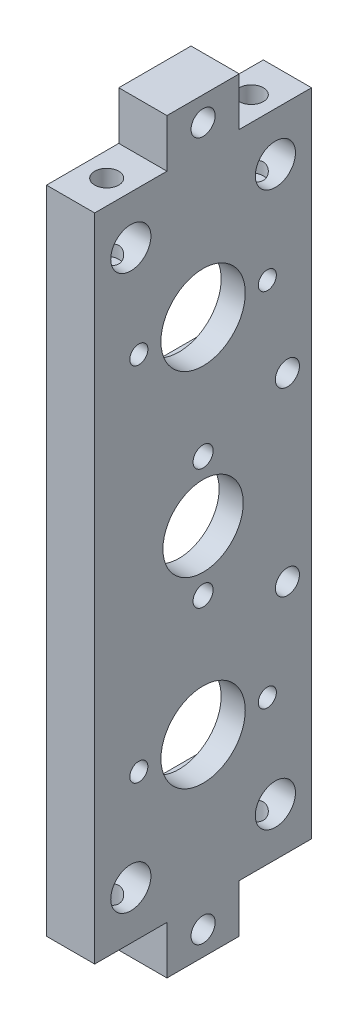
from build123d import *

# Parameters (mm, degrees)
SKETCH2_W           = 54
SKETCH2_H           = 162
SKETCH2_R           = 10
SKETCH2_R_2         = 10.5
BOSS_EXTRUDE1_DEPTH = 12
SKETCH3_W           = 18
SKETCH3_H           = 12
BOSS_EXTRUDE2_DEPTH = 12
CUT_EXTRUDE1_REACH  = 99.581
SKETCH4_R           = 2.25
LPATTERN1_COUNT     = 2
LPATTERN1_PITCH     = 90
CUT_EXTRUDE2_DEPTH  = 6
CUT_EXTRUDE3_REACH  = 99.581
SKETCH6_R           = 5
SKETCH8_R           = 5
CUT_EXTRUDE4_DEPTH  = 6
CUT_EXTRUDE5_REACH  = 99.026
SKETCH9_R           = 3
SKETCH10_R          = 3
CUT_EXTRUDE6_DEPTH  = 19
CUT_EXTRUDE7_REACH  = 99.581
SKETCH11_R          = 3
CUT_EXTRUDE8_DEPTH  = 6
CUT_EXTRUDE9_REACH  = 99.581
SKETCH13_R          = 2.5
CUT_EXTRUDE10_DEPTH = 6


with BuildPart() as part:
    # Sketch2 → Boss-Extrude1 (new body)
    with BuildSketch(Plane(origin=(0, 0, 0), x_dir=(0, 0, -1), z_dir=(1, 0, 0))):
        Rectangle(SKETCH2_W, SKETCH2_H)
        Circle(SKETCH2_R, mode=Mode.SUBTRACT)
        with Locations((0, 45)):
            Circle(SKETCH2_R_2, mode=Mode.SUBTRACT)
        with Locations((0, -45)):
            Circle(SKETCH2_R_2, mode=Mode.SUBTRACT)
    extrude(amount=BOSS_EXTRUDE1_DEPTH)

    # Sketch3 → Boss-Extrude2 (add)
    with BuildSketch(Plane(origin=(12, 0, 0), x_dir=(0, 0, -1), z_dir=(1, 0, 0))):
        with Locations((0, -87)):
            Rectangle(SKETCH3_W, SKETCH3_H)
    boss_extrude2 = extrude(amount=-BOSS_EXTRUDE2_DEPTH)

    # Mirror1: Boss-Extrude2 across plane
    add(boss_extrude2.mirror(Plane.ZX))

    # Sketch4 → Cut-Extrude1 (cut, up to next)
    with BuildSketch(Plane(origin=(12, 0, 0), x_dir=(0, 0, -1), z_dir=(1, 0, 0)), mode=Mode.PRIVATE) as cut_extrude1_sk1:
        with Locations((-16, -45)):
            Circle(SKETCH4_R)
    cut_extrude1_tool1 = extrude(cut_extrude1_sk1.sketch, amount=-CUT_EXTRUDE1_REACH, mode=Mode.PRIVATE) & part.part
    # Sketch4 → Cut-Extrude1 (cut, up to next)
    with BuildSketch(Plane(origin=(12, 0, 0), x_dir=(0, 0, -1), z_dir=(1, 0, 0)), mode=Mode.PRIVATE) as cut_extrude1_sk2:
        with Locations((16, -45)):
            Circle(SKETCH4_R)
    cut_extrude1_tool2 = extrude(cut_extrude1_sk2.sketch, amount=-CUT_EXTRUDE1_REACH, mode=Mode.PRIVATE) & part.part
    cut_extrude1_1 = cut_extrude1_tool1.solids().sort_by_distance((12, -45, 16))[0]
    add(cut_extrude1_1, mode=Mode.SUBTRACT)
    cut_extrude1_2 = cut_extrude1_tool2.solids().sort_by_distance((12, -45, -16))[0]
    add(cut_extrude1_2, mode=Mode.SUBTRACT)
    cut_extrude1 = cut_extrude1_1 + cut_extrude1_2  # Cut-Extrude1 as one shape, for the pattern or mirror that repeats it

    # LPattern1: Cut-Extrude1 ×2
    with Locations(*[(0, i * LPATTERN1_PITCH, 0) for i in range(1, LPATTERN1_COUNT)]):
        add(cut_extrude1, mode=Mode.SUBTRACT)

    # Sketch5 → Cut-Extrude2 (cut)
    with BuildSketch(Plane.ZY):
        with BuildLine():
            Line((16.992645468, 29.5), (-16.992645468, 29.5))
            ThreePointArc((-16.992645468, 29.5), (-23, 45), (-16.992645468, 60.5))
            Line((-16.992645468, 60.5), (16.992645468, 60.5))
            ThreePointArc((16.992645468, 60.5), (23, 45), (16.992645468, 29.5))
        make_face()
        with BuildLine():
            Line((16.992645468, -60.5), (-16.992645468, -60.5))
            ThreePointArc((-16.992645468, -60.5), (-23, -45), (-16.992645468, -29.5))
            Line((-16.992645468, -29.5), (16.992645468, -29.5))
            ThreePointArc((16.992645468, -29.5), (23, -45), (16.992645468, -60.5))
        make_face()
    extrude(amount=-CUT_EXTRUDE2_DEPTH, mode=Mode.SUBTRACT)

    # Sketch6 → Cut-Extrude3 (cut, up to next)
    with BuildSketch(Plane.ZY, mode=Mode.PRIVATE) as cut_extrude3_sk1:
        with Locations((-18, -69)):
            Circle(SKETCH6_R)
    cut_extrude3_tool1 = extrude(cut_extrude3_sk1.sketch, amount=-CUT_EXTRUDE3_REACH, mode=Mode.PRIVATE) & part.part
    # Sketch6 → Cut-Extrude3 (cut, up to next)
    with BuildSketch(Plane.ZY, mode=Mode.PRIVATE) as cut_extrude3_sk2:
        with Locations((18, -69)):
            Circle(SKETCH6_R)
    cut_extrude3_tool2 = extrude(cut_extrude3_sk2.sketch, amount=-CUT_EXTRUDE3_REACH, mode=Mode.PRIVATE) & part.part
    cut_extrude3_1 = cut_extrude3_tool1.solids().sort_by_distance((0, -69, -18))[0]
    add(cut_extrude3_1, mode=Mode.SUBTRACT)
    cut_extrude3_2 = cut_extrude3_tool2.solids().sort_by_distance((0, -69, 18))[0]
    add(cut_extrude3_2, mode=Mode.SUBTRACT)
    cut_extrude3 = cut_extrude3_1 + cut_extrude3_2  # Cut-Extrude3 as one shape, for the pattern or mirror that repeats it

    # Sketch8 → Cut-Extrude4 (cut)
    with BuildSketch(Plane.ZY):
        with Locations((0, -87)):
            Circle(SKETCH8_R)
    cut_extrude4 = extrude(amount=-CUT_EXTRUDE4_DEPTH, mode=Mode.SUBTRACT)

    # Sketch9 → Cut-Extrude5 (cut, up to next)
    with BuildSketch(Plane.ZY.offset(-6), mode=Mode.PRIVATE) as cut_extrude5_sk1:
        with Locations((0, -87)):
            Circle(SKETCH9_R)
    cut_extrude5_tool1 = extrude(cut_extrude5_sk1.sketch, amount=-CUT_EXTRUDE5_REACH, mode=Mode.PRIVATE) & part.part
    cut_extrude5 = cut_extrude5_tool1.solids().sort_by_distance((6, -87, 0))[0]
    add(cut_extrude5, mode=Mode.SUBTRACT)

    # Sketch10 → Cut-Extrude6 (cut)
    with BuildSketch(Plane.XZ.offset(81)):
        with Locations((6, -18)):
            Circle(SKETCH10_R)
        with Locations((6, 18)):
            Circle(SKETCH10_R)
    cut_extrude6 = extrude(amount=-CUT_EXTRUDE6_DEPTH, mode=Mode.SUBTRACT)

    # Sketch11 → Cut-Extrude7 (cut, up to next)
    with BuildSketch(Plane.ZY, mode=Mode.PRIVATE) as cut_extrude7_sk1:
        with Locations((-21, -22.5)):
            Circle(SKETCH11_R)
    cut_extrude7_tool1 = extrude(cut_extrude7_sk1.sketch, amount=-CUT_EXTRUDE7_REACH, mode=Mode.PRIVATE) & part.part
    cut_extrude7 = cut_extrude7_tool1.solids().sort_by_distance((0, -22.5, -21))[0]
    add(cut_extrude7, mode=Mode.SUBTRACT)

    # Sketch12 → Cut-Extrude8 (cut)
    with BuildSketch(Plane.ZY):
        with BuildLine():
            Line((-21, -27.5), (-27, -27.5))
            Line((-27, -27.5), (-27, -17.5))
            Line((-27, -17.5), (-21, -17.5))
            ThreePointArc((-21, -17.5), (-16, -22.5), (-21, -27.5))
        make_face()
    cut_extrude8 = extrude(amount=-CUT_EXTRUDE8_DEPTH, mode=Mode.SUBTRACT)

    # Mirror2: Cut-Extrude3, Cut-Extrude4, Cut-Extrude5, Cut-Extrude6, Cut-Extrude7, Cut-Extrude8 across plane
    add(cut_extrude3.mirror(Plane.ZX), mode=Mode.SUBTRACT)
    add(cut_extrude4.mirror(Plane.ZX), mode=Mode.SUBTRACT)
    add(cut_extrude5.mirror(Plane.ZX), mode=Mode.SUBTRACT)
    add(cut_extrude6.mirror(Plane.ZX), mode=Mode.SUBTRACT)
    add(cut_extrude7.mirror(Plane.ZX), mode=Mode.SUBTRACT)
    add(cut_extrude8.mirror(Plane.ZX), mode=Mode.SUBTRACT)

    # Sketch13 → Cut-Extrude9 (cut, up to next)
    with BuildSketch(Plane.ZY, mode=Mode.PRIVATE) as cut_extrude9_sk1:
        with Locations((0, 15)):
            Circle(SKETCH13_R)
    cut_extrude9_tool1 = extrude(cut_extrude9_sk1.sketch, amount=-CUT_EXTRUDE9_REACH, mode=Mode.PRIVATE) & part.part
    # Sketch13 → Cut-Extrude9 (cut, up to next)
    with BuildSketch(Plane.ZY, mode=Mode.PRIVATE) as cut_extrude9_sk2:
        with Locations((0, -15)):
            Circle(SKETCH13_R)
    cut_extrude9_tool2 = extrude(cut_extrude9_sk2.sketch, amount=-CUT_EXTRUDE9_REACH, mode=Mode.PRIVATE) & part.part
    add(cut_extrude9_tool1.solids().sort_by_distance((0, 15, 0))[0], mode=Mode.SUBTRACT)
    add(cut_extrude9_tool2.solids().sort_by_distance((0, -15, 0))[0], mode=Mode.SUBTRACT)

    # Sketch14 → Cut-Extrude10 (cut)
    with BuildSketch(Plane.ZY):
        with BuildLine():
            Line((-16, 12.816005618), (-16, -12.816005618))
            ThreePointArc((-16, -12.816005618), (20.5, 0), (-16, 12.816005618))
        make_face()
    extrude(amount=-CUT_EXTRUDE10_DEPTH, mode=Mode.SUBTRACT)


solid = part.part
